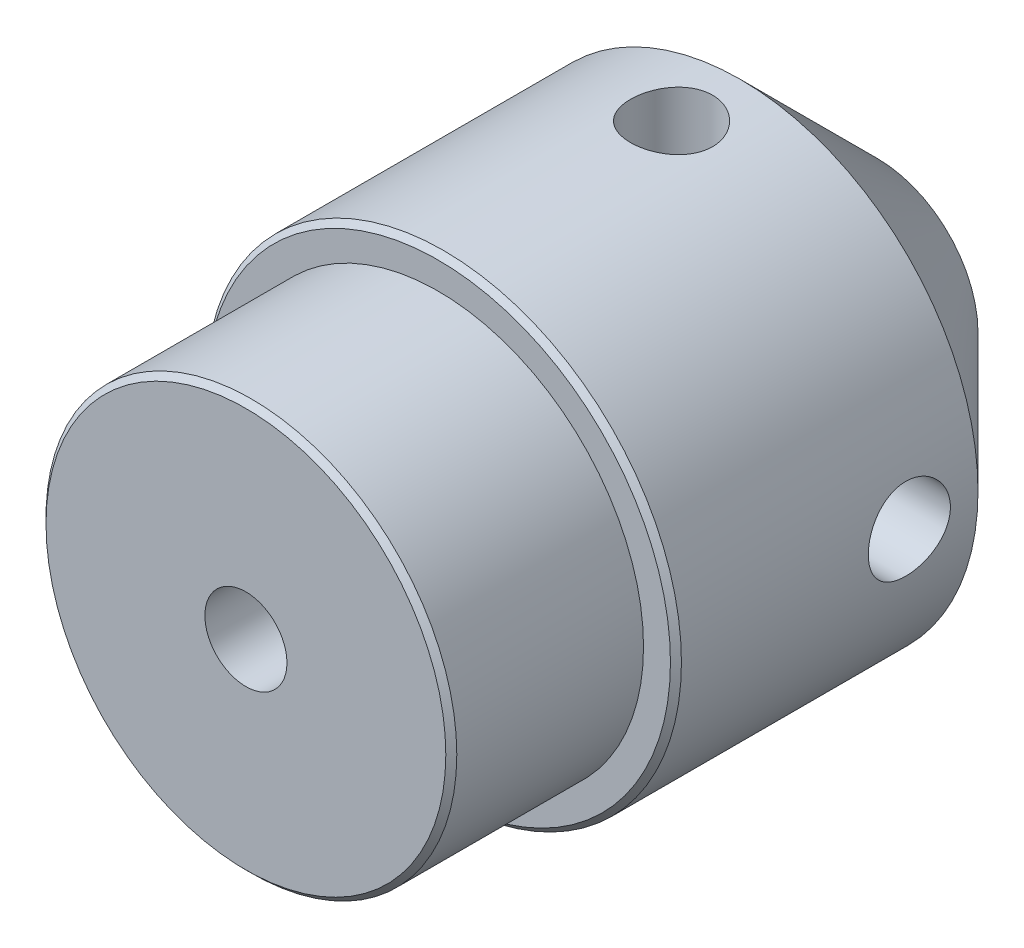
from build123d import *

# Parameters (mm, degrees)
SKETCH1_R                    = 11
BOSS_EXTRUDE1_DEPTH          = 20.32
SKETCH5_R                    = 9.5
BOSS_EXTRUDE6_DEPTH          = 8.89
B_0_238_DIAMETER_HOLE1_D     = 6.0452
B_0_238_DIAMETER_HOLE1_DEPTH = 19.05
B_0_238_DIAMETER_HOLE1_TIP   = 1.816161307
F_10_24_TAPPED_HOLE1_REACH   = 33.504
F_10_24_TAPPED_HOLE1_BORE_R  = 1.89865
F_10_24_TAPPED_HOLE2_D       = 3.7973
CHAMFER1_SIZE                = 6.35
CHAMFER2_SIZE                = 0.254
CIRPATTERN1_COUNT            = 2
CIRPATTERN1_ANGLE            = 90


with BuildPart() as part:
    # Sketch1 → Boss-Extrude1 (new body)
    with BuildSketch(Plane.XY):
        Circle(SKETCH1_R)
    extrude(amount=BOSS_EXTRUDE1_DEPTH)

    # Sketch5 → Boss-Extrude6 (add)
    with BuildSketch(Plane.XY.offset(20.32)):
        Circle(SKETCH5_R)
    extrude(amount=BOSS_EXTRUDE6_DEPTH)

    # B (0.238) Diameter Hole1
    with Locations(Plane(origin=(0, 0, 0), x_dir=(-1, 0, 0), z_dir=(0, 0, -1))):
        with Locations((0, 0)):
            Hole(B_0_238_DIAMETER_HOLE1_D / 2, depth=B_0_238_DIAMETER_HOLE1_DEPTH)
            with Locations((0, 0, -(B_0_238_DIAMETER_HOLE1_DEPTH + B_0_238_DIAMETER_HOLE1_TIP / 2))):  # 118° drill point
                Cone(0, B_0_238_DIAMETER_HOLE1_D / 2, B_0_238_DIAMETER_HOLE1_TIP, mode=Mode.SUBTRACT)

    # #10-24 Tapped Hole1 bore (on position points) → #10-24 Tapped Hole1 (cut, up to next)
    with BuildSketch(Plane(origin=(0, 11, 9.525), x_dir=(1, 0, 0), z_dir=(0, 1, 0)), mode=Mode.PRIVATE) as f_10_24_tapped_hole1_sk1:
        Circle(F_10_24_TAPPED_HOLE1_BORE_R)
    f_10_24_tapped_hole1_tool1 = extrude(f_10_24_tapped_hole1_sk1.sketch, amount=-F_10_24_TAPPED_HOLE1_REACH, mode=Mode.PRIVATE) & part.part
    f_10_24_tapped_hole1 = f_10_24_tapped_hole1_tool1.solids().sort_by_distance((0, 11, 9.525))[0]
    add(f_10_24_tapped_hole1, mode=Mode.SUBTRACT)

    # #10-24 Tapped Hole2 (through all)
    with Locations(Plane.XY.offset(29.21)):
        with Locations((0, 0)):
            Hole(F_10_24_TAPPED_HOLE2_D / 2)

    # Chamfer1
    chamfer1_edges = [part.edges().sort_by_distance(p)[0] for p in [
        (-11, 0, 0),
    ]]
    chamfer(chamfer1_edges, length=CHAMFER1_SIZE)

    # Chamfer2
    chamfer2_edges = [part.edges().sort_by_distance(p)[0] for p in [
        (-11, 0, 20.32),
        (-9.5, 0, 29.21),
    ]]
    chamfer(chamfer2_edges, length=CHAMFER2_SIZE)

    # CirPattern1: #10-24 Tapped Hole1 ×2 about axis
    cirpattern1_axis = Axis((0, 0, 20.32), (0, 0, -1))
    for i in range(1, CIRPATTERN1_COUNT):
        add(f_10_24_tapped_hole1.rotate(cirpattern1_axis, i * CIRPATTERN1_ANGLE / (CIRPATTERN1_COUNT - 1)), mode=Mode.SUBTRACT)


solid = part.part
